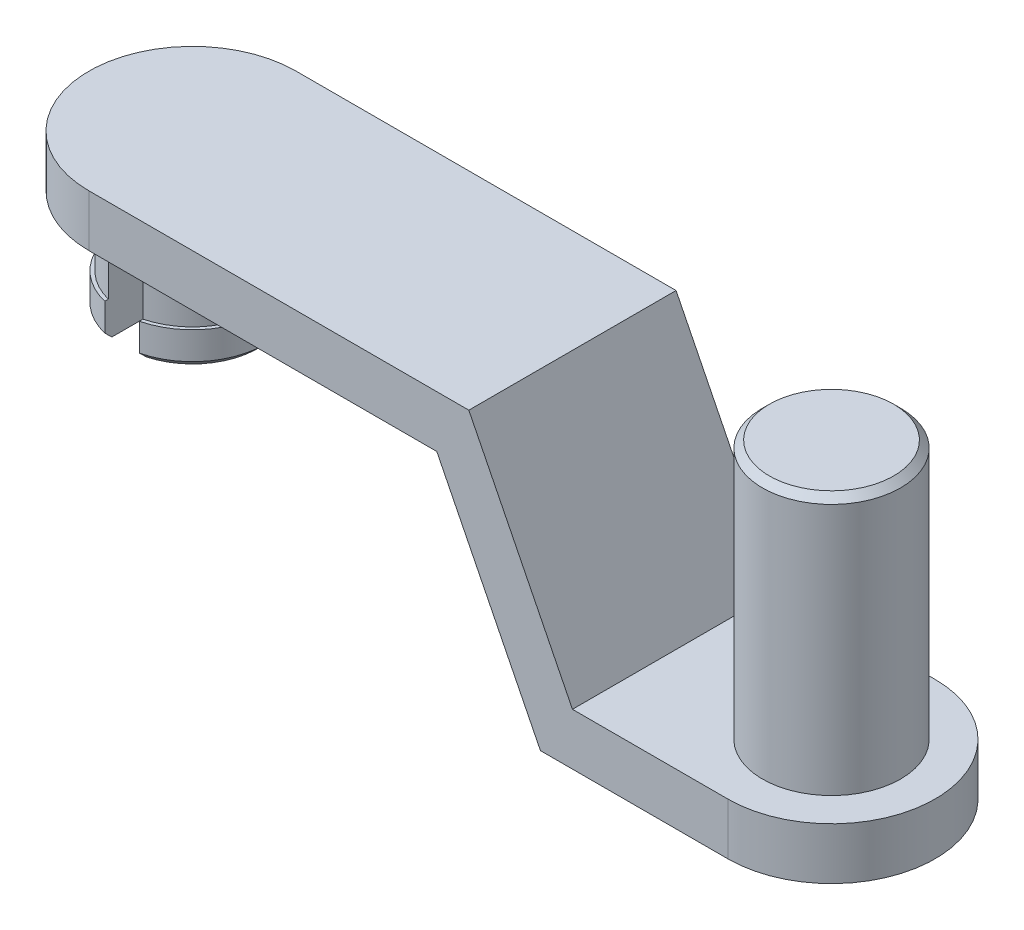
from build123d import *

# Parameters (mm, degrees)
EXTRUDE_1_DEPTH     = 6
SKETCH_2_R          = 3
EXTRUDE_2_DEPTH     = 1.5
SKETCH_3_R          = 3
EXTRUDE_3_DEPTH     = 1.5
SKETCH_4_R          = 2
EXTRUDE_4_DEPTH     = 2
SKETCH_5_R          = 2.1
EXTRUDE_5_DEPTH     = 1
CHAMFER_1_SIZE      = 0.2
SKETCH_6_W          = 1
SKETCH_6_H          = 5
CUT_EXTRUDE_1_DEPTH = 2
SKETCH_7_R          = 2
EXTRUDE_6_DEPTH     = 7.5
CHAMFER_2_SIZE      = 0.2


with BuildPart() as part:
    # 草图1 → 凸台-拉伸1 (new body)
    with BuildSketch(Plane.XY):
        Polygon((0, 0), (11, 0), (14, -6), (18.5, -6), (18.5, -7.5), (13.072949017, -7.5), (10.072949017, -1.5), (0, -1.5), align=None)
    extrude(amount=EXTRUDE_1_DEPTH)

    # 草图2 → 凸台-拉伸2 (add)
    with BuildSketch(Plane(origin=(0, 0, 0), x_dir=(1, 0, 0), z_dir=(0, 1, 0))):
        with Locations((0, -3)):
            Circle(SKETCH_2_R)
    extrude(amount=-EXTRUDE_2_DEPTH)

    # 草图3 → 凸台-拉伸3 (add)
    with BuildSketch(Plane(origin=(0, -6, 0), x_dir=(1, 0, 0), z_dir=(0, 1, 0))):
        with Locations((18.5, -3)):
            Circle(SKETCH_3_R)
    extrude(amount=-EXTRUDE_3_DEPTH)

    # 草图4 → 凸台-拉伸4 (add)
    with BuildSketch(Plane.XZ.offset(1.5)):
        with Locations(Location((0, 3, 0), (0, 0, 90))):
            Circle(SKETCH_4_R)
    extrude(amount=EXTRUDE_4_DEPTH)

    # 草图5 → 凸台-拉伸5 (add)
    with BuildSketch(Plane.XZ.offset(3.5)):
        with Locations(Location((0, 3, 0), (0, 0, 270))):
            Circle(SKETCH_5_R)
    extrude(amount=EXTRUDE_5_DEPTH)

    # 倒角1
    chamfer_1_edges = [part.edges().sort_by_distance(p)[0] for p in [
        (0, -4.5, 5.1),
    ]]
    chamfer(chamfer_1_edges, length=CHAMFER_1_SIZE)

    # 草图6 → 切除-拉伸1 (cut)
    with BuildSketch(Plane.XZ.offset(4.5)):
        with Locations((0, 3)):
            Rectangle(SKETCH_6_W, SKETCH_6_H)
    extrude(amount=-CUT_EXTRUDE_1_DEPTH, mode=Mode.SUBTRACT)

    # 草图7 → 凸台-拉伸6 (add)
    with BuildSketch(Plane(origin=(0, -6, 0), x_dir=(1, 0, 0), z_dir=(0, 1, 0))):
        with Locations((18.5, -3)):
            Circle(SKETCH_7_R)
    extrude(amount=EXTRUDE_6_DEPTH)

    # 倒角2
    chamfer_2_edges = [part.edges().sort_by_distance(p)[0] for p in [
        (16.5, 1.5, 3),
    ]]
    chamfer(chamfer_2_edges, length=CHAMFER_2_SIZE)


solid = part.part
